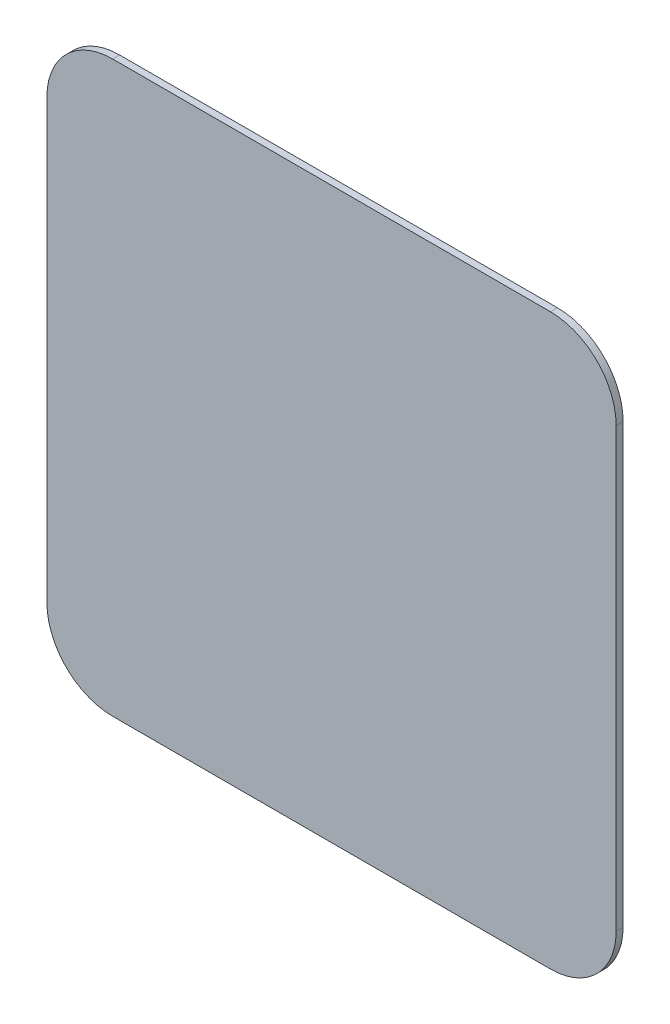
from build123d import *

# Parameters (mm, degrees)
BOSS_EXTRUDE1_DEPTH = 3.175


with BuildPart() as part:
    # Sketch1 → Boss-Extrude1 (new body)
    with BuildSketch(Plane.XY):
        with BuildLine():
            Line((79.71677043, 314.26787056), (-120.28322957, 314.26787056))
            ThreePointArc((-120.28322957, 314.26787056), (-141.496433005, 305.481073996), (-150.28322957, 284.26787056))
            Line((-150.28322957, 284.26787056), (-150.28322957, 84.26787056))
            ThreePointArc((-150.28322957, 84.26787056), (-141.496433005, 63.054667125), (-120.28322957, 54.26787056))
            Line((-120.28322957, 54.26787056), (79.71677043, 54.26787056))
            ThreePointArc((79.71677043, 54.26787056), (100.929973866, 63.054667125), (109.71677043, 84.26787056))
            Line((109.71677043, 84.26787056), (109.71677043, 284.26787056))
            ThreePointArc((109.71677043, 284.26787056), (100.929973866, 305.481073996), (79.71677043, 314.26787056))
        make_face()
    extrude(amount=-BOSS_EXTRUDE1_DEPTH)


solid = part.part
